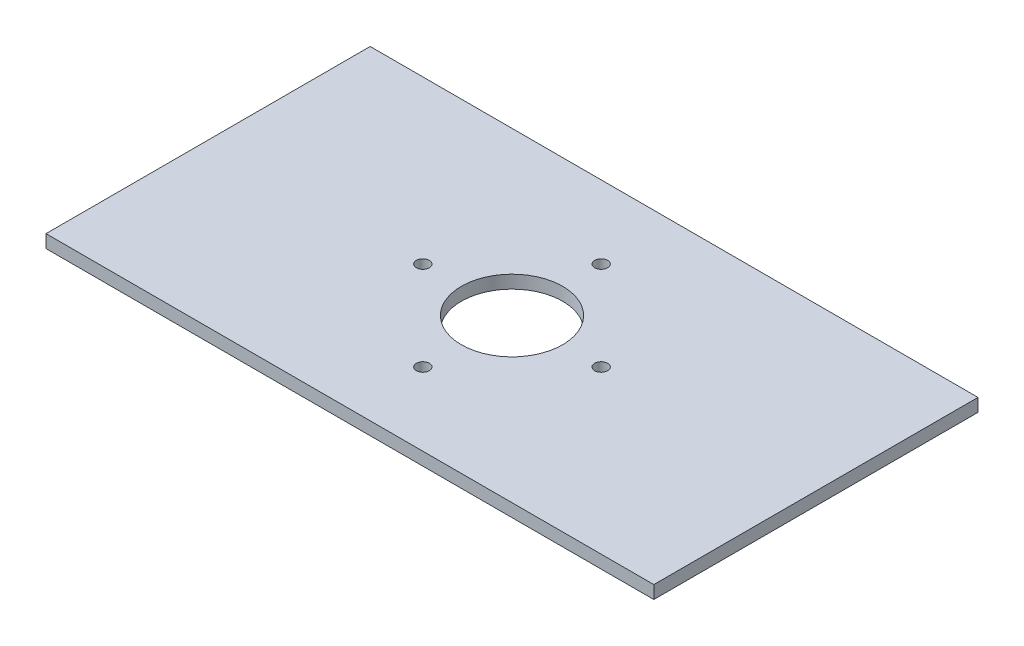
from build123d import *

# Parameters (mm, degrees)
SKETCH_1_W          = 150
SKETCH_1_H          = 80
EXTRUDE_1_DEPTH     = 3.2
SKETCH_2_R          = 12.5
CUT_EXTRUDE_1_DEPTH = 3.2
SKETCH_3_R          = 1.6
CUT_EXTRUDE_3_DEPTH = 3.2


with BuildPart() as part:
    # 草图1 → 凸台-拉伸1 (new body)
    with BuildSketch(Plane(origin=(0, 0, 0), x_dir=(1, 0, 0), z_dir=(0, 1, 0))):
        Rectangle(SKETCH_1_W, SKETCH_1_H)
    extrude(amount=EXTRUDE_1_DEPTH)

    # 草图2 → 切除-拉伸1 (cut)
    with BuildSketch(Plane(origin=(0, 3.2, 0), x_dir=(1, 0, 0), z_dir=(0, 1, 0))):
        with Locations(Location((0, 0, 0), (0, 0, 270))):
            Circle(SKETCH_2_R)
    extrude(amount=-CUT_EXTRUDE_1_DEPTH, mode=Mode.SUBTRACT)

    # 草图3 → 切除-拉伸3 (cut)
    with BuildSketch(Plane(origin=(0, 3.2, 0), x_dir=(1, 0, 0), z_dir=(0, 1, 0))):
        with Locations(Location((0, -22, 0), (0, 0, 270))):
            Circle(SKETCH_3_R)
        with Locations(Location((-22, 0, 0), (0, 0, 270))):
            Circle(SKETCH_3_R)
        with Locations(Location((0, 22, 0), (0, 0, 270))):
            Circle(SKETCH_3_R)
        with Locations(Location((22, 0, 0), (0, 0, 270))):
            Circle(SKETCH_3_R)
    extrude(amount=-CUT_EXTRUDE_3_DEPTH, mode=Mode.SUBTRACT)


solid = part.part
